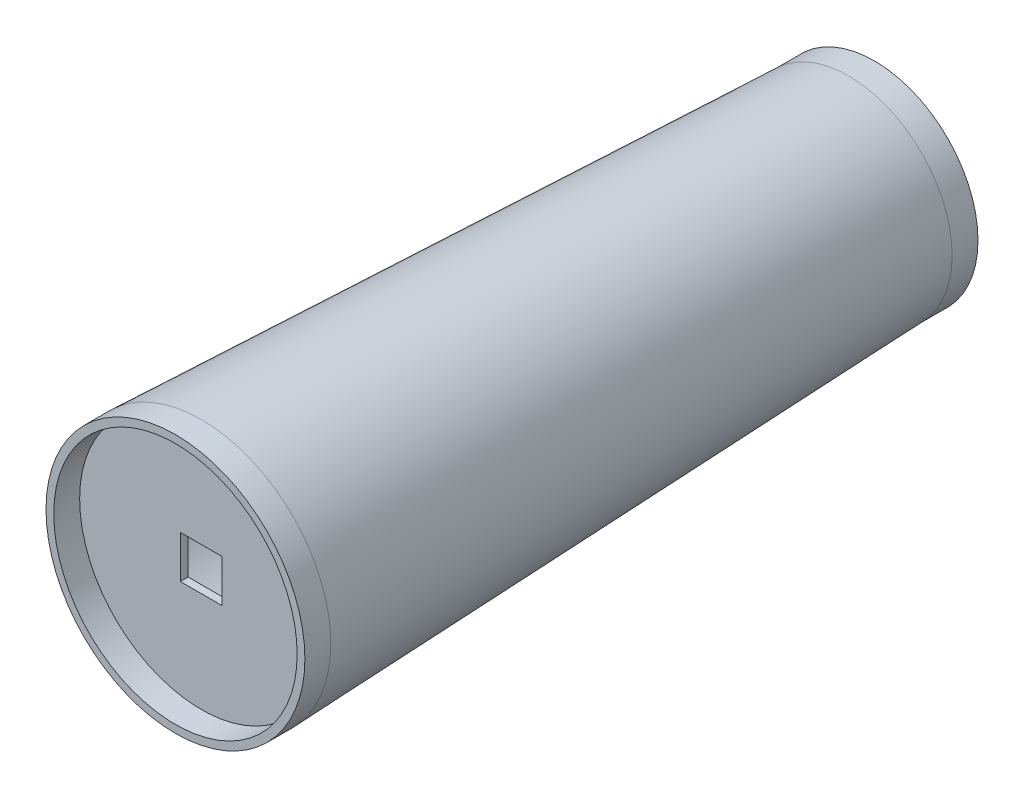
from build123d import *

# Parameters (mm, degrees)
SKETCH2_R           = 50
SKETCH2_R_2         = 47
BOSS_EXTRUDE2_DEPTH = 10
SKETCH4_W           = 16.15
SKETCH4_H           = 16.43
CUT_EXTRUDE1_DEPTH  = 10
SKETCH3_R           = 40
SKETCH3_R_2         = 37
BOSS_EXTRUDE3_DEPTH = 10


with BuildPart() as part:
    # Sketch1 → Revolve1 (revolve)
    with BuildSketch(Plane(origin=(0, 0, 0), x_dir=(0, 0, -1), z_dir=(1, 0, 0)), mode=Mode.PRIVATE) as revolve1_sk:
        Polygon((0, 0), (3, 0), (3, 47), (247, 37.24), (247, 0), (250, 0), (250, 40), (0, 50), align=None)
    revolve(revolve1_sk.sketch.rotate(Axis((0, 0, 0), (0, 0, -1)), 90), axis=Axis((0, 0, 0), (0, 0, -1)))

    # Sketch2 → Boss-Extrude2 (add)
    with BuildSketch(Plane.XY):
        Circle(SKETCH2_R)
        Circle(SKETCH2_R_2, mode=Mode.SUBTRACT)
    extrude(amount=BOSS_EXTRUDE2_DEPTH)

    # Sketch4 → Cut-Extrude1 (cut)
    with BuildSketch(Plane.XY):
        Rectangle(SKETCH4_W, SKETCH4_H)
    extrude(amount=-CUT_EXTRUDE1_DEPTH, mode=Mode.SUBTRACT)

    # Sketch3 → Boss-Extrude3 (add)
    with BuildSketch(Plane.XY.offset(-250)):
        Circle(SKETCH3_R)
        Circle(SKETCH3_R_2, mode=Mode.SUBTRACT)
    extrude(amount=-BOSS_EXTRUDE3_DEPTH)


solid = part.part
